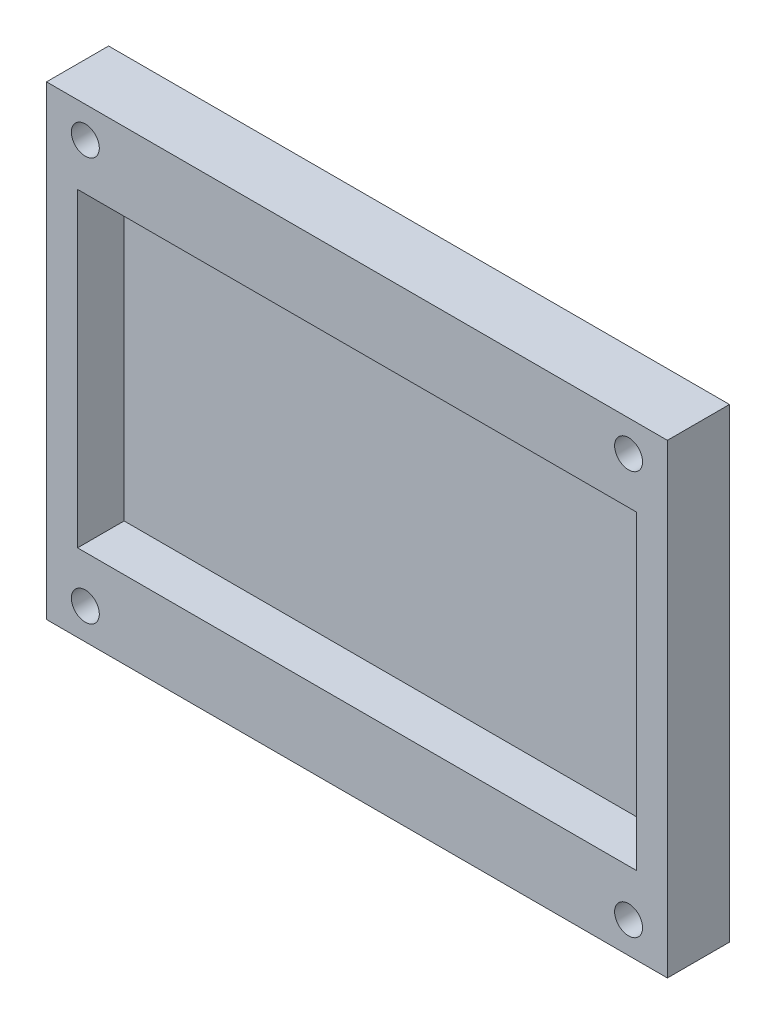
from build123d import *

# Parameters (mm, degrees)
SKETCH1_W           = 40
SKETCH1_H           = 30
BOSS_EXTRUDE1_DEPTH = 4
CUT_EXTRUDE1_START  = 4
SKETCH2_W           = 36
SKETCH2_H           = 20
CUT_EXTRUDE1_DEPTH  = 3
CUT_EXTRUDE2_START  = 4
SKETCH3_R           = 0.9
CUT_EXTRUDE2_DEPTH  = 13


with BuildPart() as part:
    # Sketch1 → Boss-Extrude1 (new body)
    with BuildSketch(Plane.XY):
        Rectangle(SKETCH1_W, SKETCH1_H)
    extrude(amount=BOSS_EXTRUDE1_DEPTH)

    # Sketch2 → Cut-Extrude1 (cut)
    with BuildSketch(Plane.XY.offset(CUT_EXTRUDE1_START)):
        Rectangle(SKETCH2_W, SKETCH2_H)
    extrude(amount=-CUT_EXTRUDE1_DEPTH, mode=Mode.SUBTRACT)

    # Sketch3 → Cut-Extrude2 (cut)
    with BuildSketch(Plane.XY.offset(CUT_EXTRUDE2_START)):
        with Locations(Location((-17.5, 13, 0), (0, 0, 180))):
            Circle(SKETCH3_R)
        with Locations(Location((-17.5, -13, 0), (0, 0, 180))):
            Circle(SKETCH3_R)
        with Locations(Location((17.5, -13, 0), (0, 0, 180))):
            Circle(SKETCH3_R)
        with Locations(Location((17.5, 13, 0), (0, 0, 180))):
            Circle(SKETCH3_R)
    extrude(amount=-CUT_EXTRUDE2_DEPTH, mode=Mode.SUBTRACT)


solid = part.part
